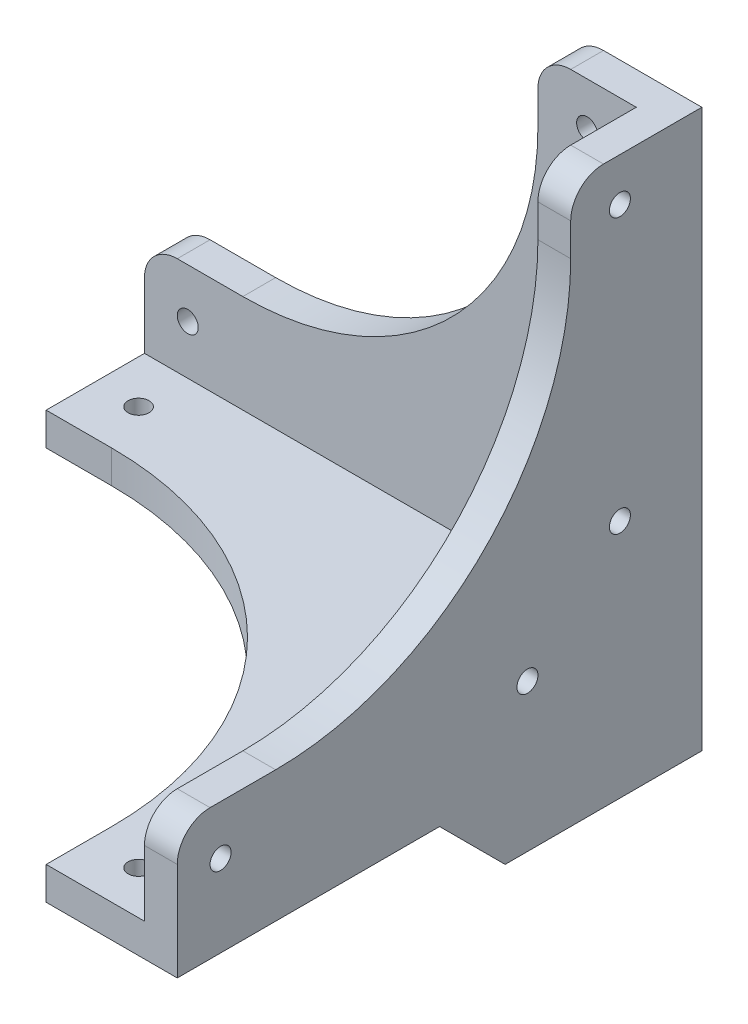
from build123d import *

# Parameters (mm, degrees)
SKETCH1_R           = 1.6
BOSS_EXTRUDE1_DEPTH = 5
SKETCH2_R           = 1.6
BOSS_EXTRUDE2_DEPTH = 5
SKETCH3_R           = 1.6
BOSS_EXTRUDE3_DEPTH = 5


with BuildPart() as part:
    # Sketch1 → Boss-Extrude1 (new body)
    with BuildSketch(Plane(origin=(0, 0, 0), x_dir=(1, 0, 0), z_dir=(0, 1, 0))):
        with BuildLine():
            Line((-50, 0), (-60, 0))
            Line((-60, 0), (-60, 15))
            Line((-60, 15), (15, 15))
            Line((15, 15), (15, -60))
            Line((15, -60), (0, -60))
            Line((0, -60), (0, -50))
            ThreePointArc((0, -50), (-14.644660941, -14.644660941), (-50, 0))
        make_face()
        with Locations(Location((7.5, 7.5, 0), (0, 0, 270))):
            Circle(SKETCH1_R, mode=Mode.SUBTRACT)
        with Locations(Location((7.5, -6.6, 0), (0, 0, 270))):
            Circle(SKETCH1_R, mode=Mode.SUBTRACT)
        with Locations(Location((7.5, -53.4, 0), (0, 0, 270))):
            Circle(SKETCH1_R, mode=Mode.SUBTRACT)
        with Locations(Location((-53.4, 7.5, 0), (0, 0, 270))):
            Circle(SKETCH1_R, mode=Mode.SUBTRACT)
        with Locations(Location((-6.6, 7.5, 0), (0, 0, 270))):
            Circle(SKETCH1_R, mode=Mode.SUBTRACT)
    extrude(amount=BOSS_EXTRUDE1_DEPTH)

    # Sketch2 → Boss-Extrude2 (add)
    with BuildSketch(Plane(origin=(15, 0, 0), x_dir=(0, 0, -1), z_dir=(1, 0, 0))):
        with BuildLine():
            Line((-10, -10), (-20, 0))
            Line((-20, 0), (-60, 0))
            Line((-60, 0), (-60, 15))
            ThreePointArc((-60, 15), (-58.535533906, 18.535533906), (-55, 20))
            Line((-55, 20), (-45, 20))
            ThreePointArc((-45, 20), (-13.180194847, 33.180194847), (0, 65))
            Line((0, 65), (0, 70))
            ThreePointArc((0, 70), (1.464466094, 73.535533906), (5, 75))
            Line((5, 75), (15, 75))
            Line((15, 75), (15, -10))
            Line((15, -10), (-10, -10))
        make_face()
        with Locations((-53.4, 12.5)):
            Circle(SKETCH2_R, mode=Mode.SUBTRACT)
        with Locations((-6.6, 12.5)):
            Circle(SKETCH2_R, mode=Mode.SUBTRACT)
        with Locations((7.5, 26.6)):
            Circle(SKETCH2_R, mode=Mode.SUBTRACT)
        with Locations((7.5, 68.4)):
            Circle(SKETCH2_R, mode=Mode.SUBTRACT)
    extrude(amount=BOSS_EXTRUDE2_DEPTH)

    # Sketch3 → Boss-Extrude3 (add)
    with BuildSketch(Plane(origin=(0, 0, -15), x_dir=(-1, 0, 0), z_dir=(0, 0, -1))):
        with BuildLine():
            Line((-20, -10), (10, -10))
            Line((10, -10), (20, 0))
            Line((20, 0), (60, 0))
            Line((60, 0), (60, 15))
            ThreePointArc((60, 15), (58.535533906, 18.535533906), (55, 20))
            Line((55, 20), (45, 20))
            ThreePointArc((45, 20), (13.180194847, 33.180194847), (0, 65))
            Line((0, 65), (0, 70))
            ThreePointArc((0, 70), (-1.464466094, 73.535533906), (-5, 75))
            Line((-5, 75), (-20, 75))
            Line((-20, 75), (-20, -10))
        make_face()
        with Locations((-7.5, 68.4)):
            Circle(SKETCH3_R, mode=Mode.SUBTRACT)
        with Locations((-7.5, 26.6)):
            Circle(SKETCH3_R, mode=Mode.SUBTRACT)
        with Locations((6.6, 12.5)):
            Circle(SKETCH3_R, mode=Mode.SUBTRACT)
        with Locations((53.4, 12.5)):
            Circle(SKETCH3_R, mode=Mode.SUBTRACT)
    extrude(amount=BOSS_EXTRUDE3_DEPTH)


solid = part.part
